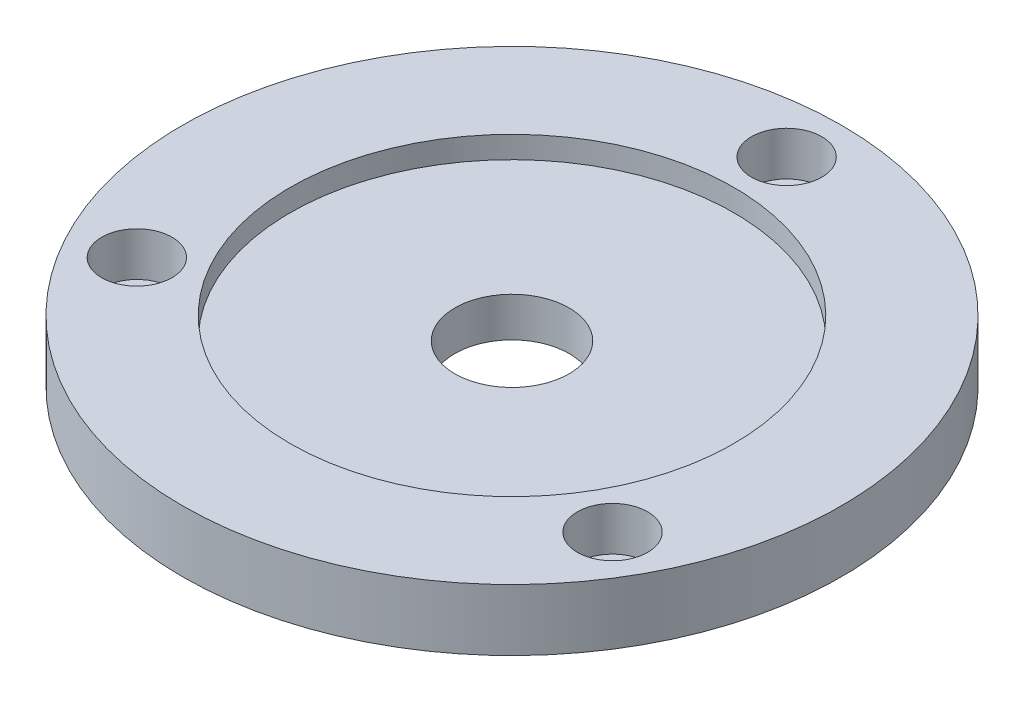
from build123d import *

# Parameters (mm, degrees)
SKETCH1_R           = 75
BOSS_EXTRUDE1_DEPTH = 14
SKETCH4_R           = 5
CUT_EXTRUDE4_DEPTH  = 107.98598039
SKETCH2_R           = 13
CUT_EXTRUDE5_DEPTH  = 107.98598039
SKETCH5_R           = 50.5
CUT_EXTRUDE6_DEPTH  = 5
SKETCH6_R           = 8
CUT_EXTRUDE7_DEPTH  = 10


with BuildPart() as part:
    # Sketch1 → Boss-Extrude1 (new body)
    with BuildSketch(Plane(origin=(0, 0, 0), x_dir=(1, 0, 0), z_dir=(0, 1, 0))):
        with Locations(Location((0, 0, 0), (0, 0, 270))):
            Circle(SKETCH1_R)
    extrude(amount=BOSS_EXTRUDE1_DEPTH)

    # Sketch4 → Cut-Extrude4 (cut, through all)
    with BuildSketch(Plane(origin=(0, 14, 0), x_dir=(1, 0, 0), z_dir=(0, 1, 0))):
        with Locations(Location((0, 62.5, 0), (0, 0, 270))):
            Circle(SKETCH4_R)
        with Locations(Location((-54.126587737, -31.25, 0), (0, 0, 270))):
            Circle(SKETCH4_R)
        with Locations(Location((54.126587737, -31.25, 0), (0, 0, 270))):
            Circle(SKETCH4_R)
    extrude(amount=-CUT_EXTRUDE4_DEPTH, mode=Mode.SUBTRACT)

    # Sketch2 → Cut-Extrude5 (cut, through all)
    with BuildSketch(Plane(origin=(0, 14, 0), x_dir=(1, 0, 0), z_dir=(0, 1, 0))):
        with Locations(Location((0, 0, 0), (0, 0, 270))):
            Circle(SKETCH2_R)
    extrude(amount=-CUT_EXTRUDE5_DEPTH, mode=Mode.SUBTRACT)

    # Sketch5 → Cut-Extrude6 (cut)
    with BuildSketch(Plane(origin=(0, 14, 0), x_dir=(-1, 0, 0), z_dir=(0, 1, 0))):
        with Locations(Location((0, 0, 0), (0, 0, 90))):
            Circle(SKETCH5_R)
    extrude(amount=-CUT_EXTRUDE6_DEPTH, mode=Mode.SUBTRACT)

    # Sketch6 → Cut-Extrude7 (cut)
    with BuildSketch(Plane(origin=(0, 14, 0), x_dir=(1, 0, 0), z_dir=(0, 1, 0))):
        with Locations(Location((-54.126587737, -31.25, 0), (0, 0, 270))):
            Circle(SKETCH6_R)
        with Locations(Location((0, 62.5, 0), (0, 0, 270))):
            Circle(SKETCH6_R)
        with Locations(Location((54.126587737, -31.25, 0), (0, 0, 270))):
            Circle(SKETCH6_R)
    extrude(amount=-CUT_EXTRUDE7_DEPTH, mode=Mode.SUBTRACT)


solid = part.part
